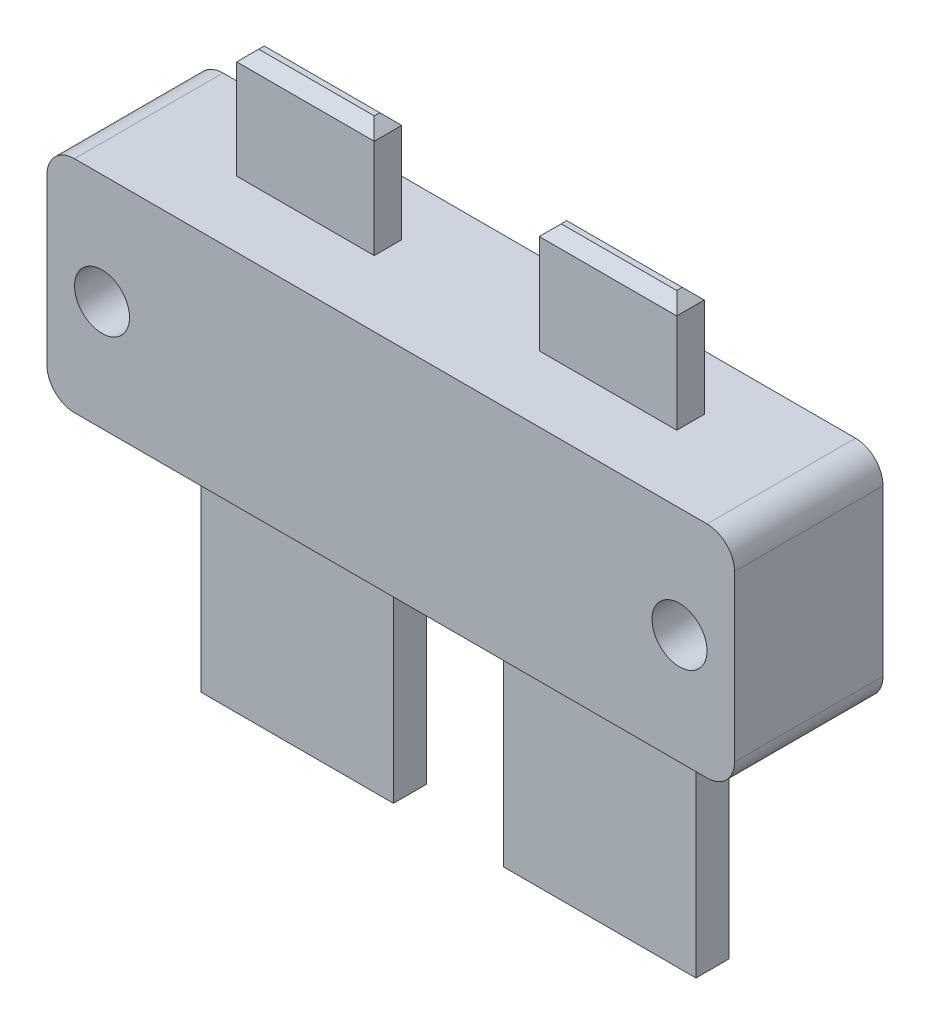
from build123d import *

# Parameters (mm, degrees)
SKETCH_1_W          = 25
SKETCH_1_H          = 8
EXTRUDE_1_DEPTH     = 5.4
SKETCH_2_W          = 7
SKETCH_2_H          = 1.2
EXTRUDE_2_DEPTH     = 9
SKETCH_3_W          = 5
SKETCH_3_H          = 1
EXTRUDE_3_DEPTH     = 4
CHAMFER_2_SIZE      = 0.4
CHAMFER_3_SIZE      = 0.4
SKETCH_4_R          = 1
CUT_EXTRUDE_1_DEPTH = 2
FILLET_1_R          = 1


with BuildPart() as part:
    # 草图1 → 凸台-拉伸1 (new body)
    with BuildSketch(Plane.XY):
        with Locations((12.5, -4)):
            Rectangle(SKETCH_1_W, SKETCH_1_H)
    extrude(amount=EXTRUDE_1_DEPTH)

    # 草图2 → 凸台-拉伸2 (add)
    with BuildSketch(Plane.XZ.offset(8)):
        with Locations((7, 2.7)):
            Rectangle(SKETCH_2_W, SKETCH_2_H)
        with Locations((18, 2.7)):
            Rectangle(SKETCH_2_W, SKETCH_2_H)
    extrude(amount=EXTRUDE_2_DEPTH)

    # 草图3 → 凸台-拉伸3 (add)
    with BuildSketch(Plane(origin=(0, 0, 0), x_dir=(1, 0, 0), z_dir=(0, 1, 0))):
        with Locations((7, -2.5)):
            Rectangle(SKETCH_3_W, SKETCH_3_H)
        with Locations((18, -2.5)):
            Rectangle(SKETCH_3_W, SKETCH_3_H)
    extrude(amount=EXTRUDE_3_DEPTH)

    # 倒角2
    chamfer_2_edges = [part.edges().sort_by_distance(p)[0] for p in [
        (3.5, -17, 2.7),
        (10.5, -17, 2.7),
        (14.5, -17, 2.7),
        (21.5, -17, 2.7),
        (4.5, 4, 2.5),
        (9.5, 4, 2.5),
        (15.5, 4, 2.5),
        (20.5, 4, 2.5),
    ]]
    chamfer(chamfer_2_edges, length=CHAMFER_2_SIZE)

    # 倒角3
    chamfer_3_edges = [part.edges().sort_by_distance(p)[0] for p in [
        (7, 4, 2),
        (7, 4, 3),
        (18, 4, 2),
        (18, 4, 3),
        (18, -17, 2.1),
        (18, -17, 3.3),
        (7, -17, 2.1),
        (7, -17, 3.3),
    ]]
    chamfer(chamfer_3_edges, length=CHAMFER_3_SIZE)

    # 草图4 → 切除-拉伸1 (cut)
    with BuildSketch(Plane.XY.offset(5.4)):
        with Locations((2, -4)):
            Circle(SKETCH_4_R)
        with Locations((23, -4)):
            Circle(SKETCH_4_R)
    extrude(amount=-CUT_EXTRUDE_1_DEPTH, mode=Mode.SUBTRACT)

    # 圆角1
    fillet_1_edges = [part.edges().sort_by_distance(p)[0] for p in [
        (0, 0, 2.7),
        (25, 0, 2.7),
        (25, -8, 2.7),
        (0, -8, 2.7),
    ]]
    fillet(fillet_1_edges, radius=FILLET_1_R)


solid = part.part
